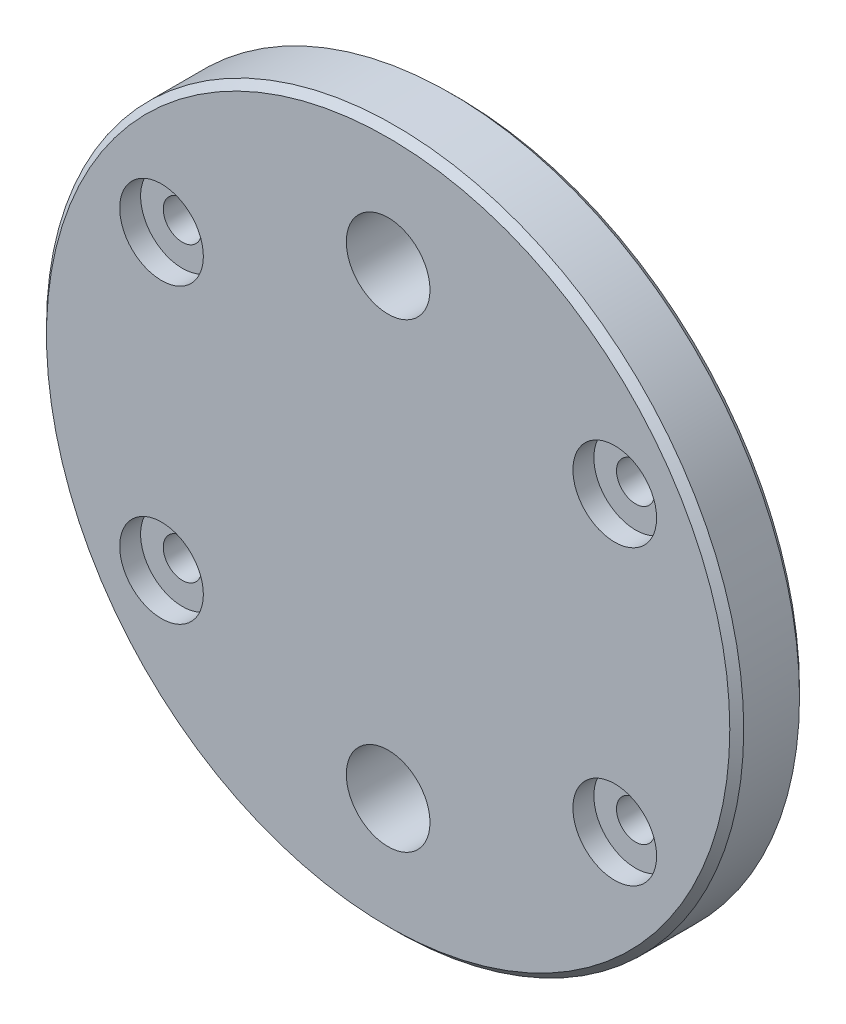
from build123d import *

# Parameters (mm, degrees)
SKETCH1_R                                            = 50
BOSS_EXTRUDE1_DEPTH                                  = 10
CBORE_FOR_M6_HEX_SOCKET_HEAD_CAP_SCREW1_D            = 5.5
CBORE_FOR_M6_HEX_SOCKET_HEAD_CAP_SCREW1_CBORE_D      = 12
CBORE_FOR_M6_HEX_SOCKET_HEAD_CAP_SCREW1_CBORE_DEPTH  = 3
F_12_0_12_DIAMETER_HOLE1_D                           = 12
CSK_FOR_M3_HEX_SOCKET_COUNTERSUNK_CAP_SC_D           = 5.5
CSK_FOR_M3_HEX_SOCKET_COUNTERSUNK_CAP_SC_CSINK_D     = 11.2
CSK_FOR_M3_HEX_SOCKET_COUNTERSUNK_CAP_SC_CSINK_ANGLE = 90
CHAMFER1_SIZE                                        = 1


with BuildPart() as part:
    # Sketch1 → Boss-Extrude1 (new body)
    with BuildSketch(Plane.XY):
        Circle(SKETCH1_R)
    extrude(amount=BOSS_EXTRUDE1_DEPTH)

    # CBORE for M6 Hex Socket Head Cap Screw1 (through all)
    with Locations(Plane.XY.offset(10)):
        with Locations((-32.5, 21), (32.5, 21), (32.5, -21), (-32.5, -21)):
            CounterBoreHole(CBORE_FOR_M6_HEX_SOCKET_HEAD_CAP_SCREW1_D / 2, CBORE_FOR_M6_HEX_SOCKET_HEAD_CAP_SCREW1_CBORE_D / 2, CBORE_FOR_M6_HEX_SOCKET_HEAD_CAP_SCREW1_CBORE_DEPTH)

    # Ø12.0 (12) Diameter Hole1 (through all)
    with Locations(Plane.XY.offset(10)):
        with Locations((0, 33.07), (0, -33.07)):
            Hole(F_12_0_12_DIAMETER_HOLE1_D / 2)

    # CSK for M3 Hex Socket Countersunk Cap Screw1 (through all)
    with Locations(Plane(origin=(0, 0, 0), x_dir=(-1, 0, 0), z_dir=(0, 0, -1))):
        with Locations((-32.5, 21), (-32.5, -21), (32.5, -21), (32.5, 21)):
            CounterSinkHole(CSK_FOR_M3_HEX_SOCKET_COUNTERSUNK_CAP_SC_D / 2, CSK_FOR_M3_HEX_SOCKET_COUNTERSUNK_CAP_SC_CSINK_D / 2, counter_sink_angle=CSK_FOR_M3_HEX_SOCKET_COUNTERSUNK_CAP_SC_CSINK_ANGLE)

    # Chamfer1
    chamfer1_edges = [part.edges().sort_by_distance(p)[0] for p in [
        (-50, 0, 0),
        (-50, 0, 10),
    ]]
    chamfer(chamfer1_edges, length=CHAMFER1_SIZE)


solid = part.part
